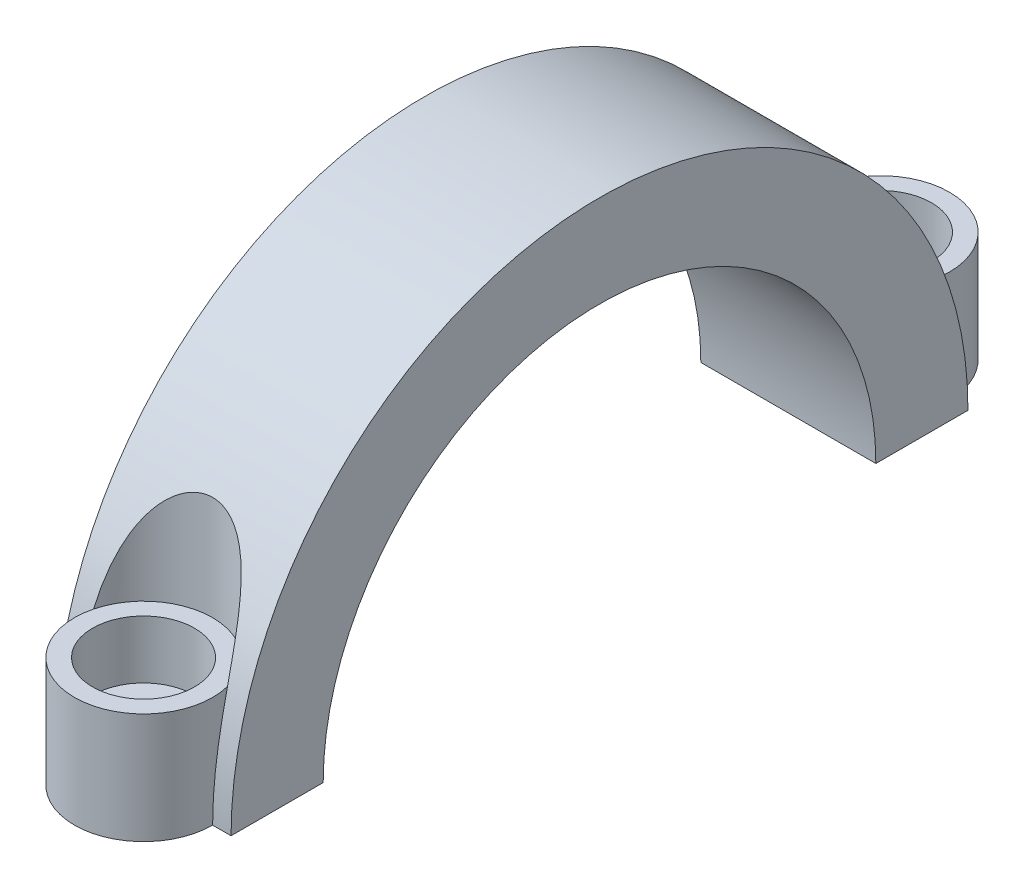
from build123d import *

# Parameters (mm, degrees)
BOSS_EXTRUDE1_DEPTH = 12.065
SKETCH2_6_R         = 9.525
CUT_EXTRUDE1_DEPTH  = 68.25
SKETCH2_R           = 9.525
SKETCH2_R_2         = 7.025
BOSS_EXTRUDE2_DEPTH = 15.25
SKETCH2_8_R         = 7.025
SKETCH2_8_R_2       = 3.4
BOSS_EXTRUDE3_DEPTH = 7.25


with BuildPart() as part:
    # Sketch1 → Boss-Extrude1 (new, symmetric)
    with BuildSketch(Plane(origin=(0, 0, 0), x_dir=(0, 0, -1), z_dir=(1, 0, 0))):
        with BuildLine():
            Line((38.1, 0), (50.8, 0))
            ThreePointArc((50.8, 0), (0, 50.8), (-50.8, 0))
            Line((-50.8, 0), (-38.1, 0))
            ThreePointArc((-38.1, 0), (0, 38.1), (38.1, 0))
        make_face()
        with BuildLine():
            ThreePointArc((-38.1, 0), (0, 38.1), (38.1, 0))
            Line((38.1, 0), (50.8, 0))
            ThreePointArc((50.8, 0), (0, 50.8), (-50.8, 0))
            Line((-50.8, 0), (-38.1, 0))
        make_face()
        with BuildLine():
            ThreePointArc((-38.1, 0), (0, 38.1), (38.1, 0))
            Line((38.1, 0), (50.8, 0))
            ThreePointArc((50.8, 0), (0, 50.8), (-50.8, 0))
            Line((-50.8, 0), (-38.1, 0))
        make_face()
    extrude(amount=BOSS_EXTRUDE1_DEPTH, both=True)

    # Sketch2<6> → Cut-Extrude1 (cut)
    with BuildSketch(Plane.XZ):
        with Locations((0, -50.8)):
            Circle(SKETCH2_6_R)
        with Locations((0, 50.8)):
            Circle(SKETCH2_6_R)
    extrude(amount=-CUT_EXTRUDE1_DEPTH, mode=Mode.SUBTRACT)

    # Sketch2 → Boss-Extrude2 (add)
    # profile 1 of 2: a face of its own
    with BuildSketch(Plane.XZ):
        with Locations((0, -50.8)):
            Circle(SKETCH2_R)
        with Locations((0, -50.8)):
            Circle(SKETCH2_R_2, mode=Mode.SUBTRACT)
    # profile 2 of 2: a face of its own
    with BuildSketch(Plane.XZ):
        with Locations((0, 50.8)):
            Circle(SKETCH2_R)
        with Locations((0, 50.8)):
            Circle(SKETCH2_R_2, mode=Mode.SUBTRACT)
    extrude(amount=-BOSS_EXTRUDE2_DEPTH)

    # Sketch2<8> → Boss-Extrude3 (add)
    # profile 1 of 2: a face of its own
    with BuildSketch(Plane.XZ):
        with Locations((0, -50.8)):
            Circle(SKETCH2_8_R)
        with Locations((0, -50.8)):
            Circle(SKETCH2_8_R_2, mode=Mode.SUBTRACT)
    # profile 2 of 2: a face of its own
    with BuildSketch(Plane.XZ):
        with Locations((0, 50.8)):
            Circle(SKETCH2_8_R)
        with Locations((0, 50.8)):
            Circle(SKETCH2_8_R_2, mode=Mode.SUBTRACT)
    extrude(amount=-BOSS_EXTRUDE3_DEPTH)


solid = part.part
